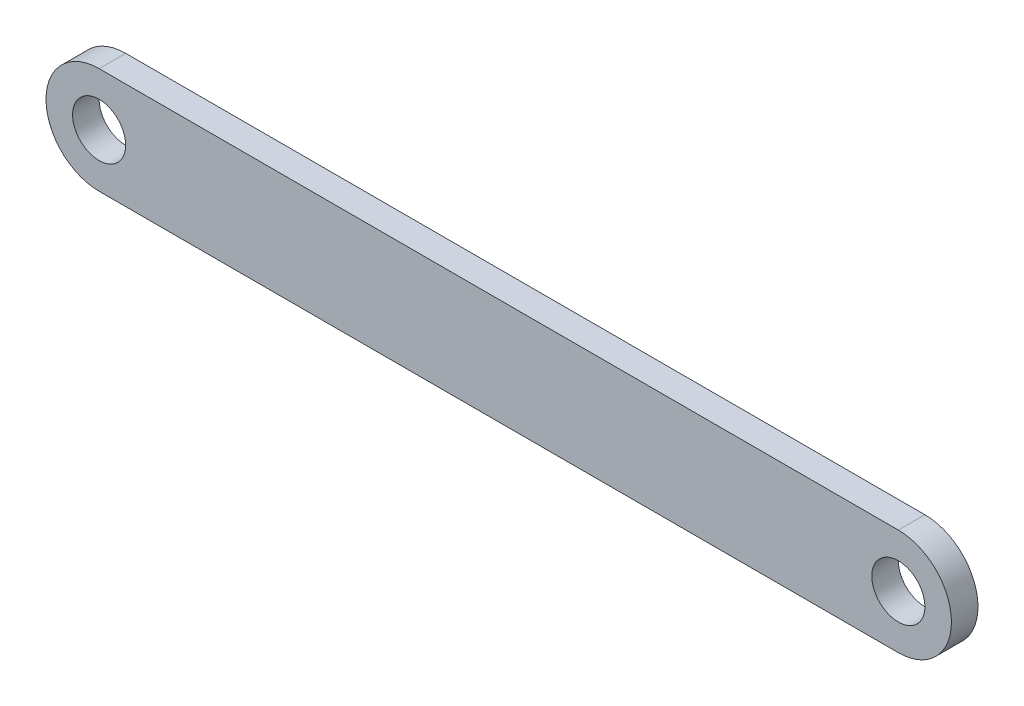
from build123d import *

# Parameters (mm, degrees)
SKETCH1_R           = 12.7
BOSS_EXTRUDE1_DEPTH = 6.35


with BuildPart() as part:
    # Sketch1 → Boss-Extrude1 (new, symmetric)
    with BuildSketch(Plane.XY):
        with BuildLine():
            Line((-191.135, 25.4), (191.135, 25.4))
            ThreePointArc((191.135, 25.4), (216.535, 0), (191.135, -25.4))
            Line((191.135, -25.4), (-191.135, -25.4))
            ThreePointArc((-191.135, -25.4), (-216.535, 0), (-191.135, 25.4))
        make_face()
        with Locations((-191.135, 0)):
            Circle(SKETCH1_R, mode=Mode.SUBTRACT)
        with Locations((191.135, 0)):
            Circle(SKETCH1_R, mode=Mode.SUBTRACT)
    extrude(amount=BOSS_EXTRUDE1_DEPTH, both=True)


solid = part.part
